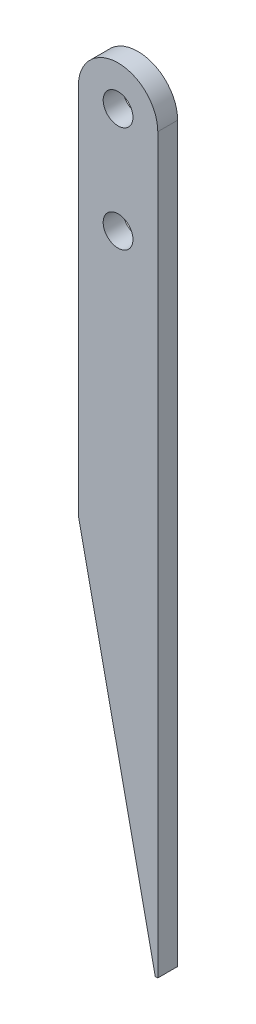
from build123d import *

# Parameters (mm, degrees)
SKETCH_1_R          = 1.5
EXTRUDE_1_DEPTH     = 2
CUT_EXTRUDE_1_DEPTH = 2


with BuildPart() as part:
    # 草图1 → 凸台-拉伸1 (new body)
    with BuildSketch(Plane.XY):
        with BuildLine():
            Line((4, 0), (4, -75))
            Line((4, -75), (-4, -37.5))
            Line((-4, -37.5), (-4, 0))
            ThreePointArc((-4, 0), (0, 4), (4, 0))
        make_face()
        Circle(SKETCH_1_R, mode=Mode.SUBTRACT)
        with Locations((0, -10.66)):
            Circle(SKETCH_1_R, mode=Mode.SUBTRACT)
    extrude(amount=EXTRUDE_1_DEPTH)

    # 草图2 → 切除-拉伸1 (cut)
    with BuildSketch(Plane.XY.offset(2)):
        Polygon((4, -73.818025818), (3.747845508, -73.818025818), (4, -75), align=None)
    extrude(amount=-CUT_EXTRUDE_1_DEPTH, mode=Mode.SUBTRACT)


solid = part.part
